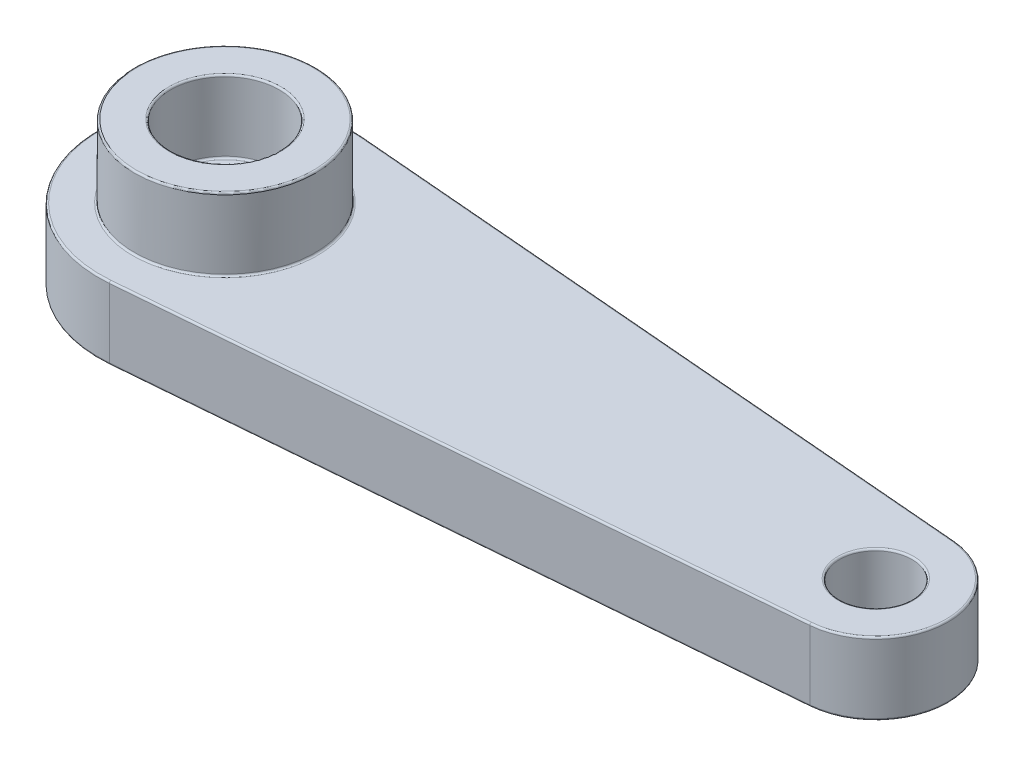
from build123d import *

# Parameters (mm, degrees)
SKETCH1_R           = 2.5
SKETCH1_R_2         = 1.5
BOSS_EXTRUDE1_DEPTH = 2
SKETCH2_R           = 1
SKETCH2_R_2         = 0.5
BOSS_EXTRUDE2_DEPTH = 2
CUT_EXTRUDE1_START  = -0.5
SKETCH3_R           = 2
SKETCH3_R_2         = 0.5
CUT_EXTRUDE1_DEPTH  = 0.5
FILLET1_R           = 0.05


with BuildPart() as part:
    # Sketch1 → Boss-Extrude1 (new body)
    with BuildSketch(Plane(origin=(0, 0, 0), x_dir=(1, 0, 0), z_dir=(0, 1, 0))):
        with Locations(Location((0, 0, 0), (0, 0, 270))):
            Circle(SKETCH1_R)
        with Locations(Location((0, 0, 0), (0, 0, 270))):
            Circle(SKETCH1_R_2, mode=Mode.SUBTRACT)
    extrude(amount=BOSS_EXTRUDE1_DEPTH)

    # Sketch2 → Boss-Extrude2 (add)
    with BuildSketch(Plane(origin=(0, 0, 0), x_dir=(1, 0, 0), z_dir=(0, 1, 0))):
        with BuildLine():
            Line((0.291666667, 3.48782605), (18.166666667, 1.993043457))
            ThreePointArc((18.166666667, 1.993043457), (20, 0), (18.166666667, -1.993043457))
            Line((18.166666667, -1.993043457), (0.291666667, -3.48782605))
            ThreePointArc((0.291666667, -3.48782605), (-3.5, 0), (0.291666667, 3.48782605))
        make_face()
        with Locations(Location((18, 0, 0), (0, 0, 270))):
            Circle(SKETCH2_R, mode=Mode.SUBTRACT)
        with Locations(Location((0, 0, 0), (0, 0, 270))):
            Circle(SKETCH2_R_2, mode=Mode.SUBTRACT)
    extrude(amount=-BOSS_EXTRUDE2_DEPTH)

    # Sketch3 → Cut-Extrude1 (cut)
    with BuildSketch(Plane.XZ.offset(2).offset(CUT_EXTRUDE1_START)):
        with Locations(Location((0, 0, 0), (0, 0, 270))):
            Circle(SKETCH3_R)
        with Locations(Location((0, 0, 0), (0, 0, 90))):
            Circle(SKETCH3_R_2, mode=Mode.SUBTRACT)
    extrude(amount=CUT_EXTRUDE1_DEPTH, mode=Mode.SUBTRACT)

    # Fillet1
    fillet1_edges = [part.edges().sort_by_distance(p)[0] for p in [
        (0, 0, -2.5),
        (-3.5, -2, 0),
        (9.229166667, -2, -2.740434754),
        (20, -2, 0),
        (9.229166667, -2, 2.740434754),
        (18, -2, -1),
        (-3.5, 0, 0),
        (9.229166667, 0, 2.740434754),
        (20, 0, 0),
        (9.229166667, 0, -2.740434754),
        (18, 0, -1),
        (0, 0, -0.5),
        (0, -1.5, 2),
        (0, -1.5, -0.5),
        (0, -2, 2),
        (0, 2, -2.5),
        (0, 0, -1.5),
        (0, 2, -1.5),
    ]]
    fillet(fillet1_edges, radius=FILLET1_R)


solid = part.part
